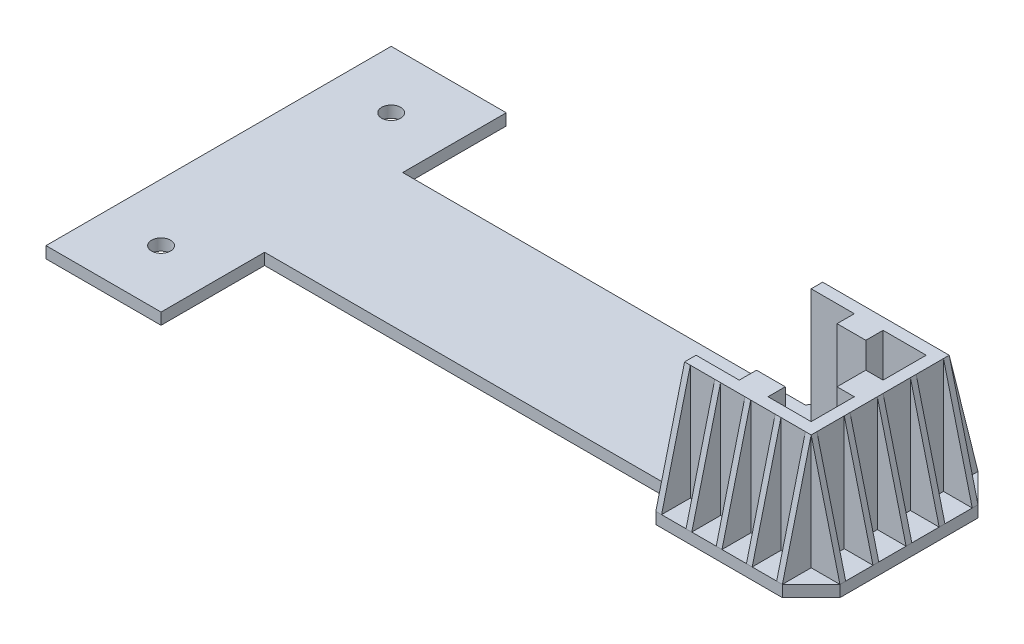
from build123d import *

# Parameters (mm, degrees)
SKETCH1_R           = 1.65
SKETCH1_R_2         = 2.5
BOSS_EXTRUDE1_DEPTH = 2
BOSS_EXTRUDE2_DEPTH = 20
SKETCH4_W           = 1
SKETCH4_H           = 5
BOSS_EXTRUDE3_DEPTH = 22
SKETCH5_W           = 5
SKETCH5_H           = 1
BOSS_EXTRUDE4_DEPTH = 22
BOSS_EXTRUDE5_DEPTH = 2
CHAMFER1_SIZE       = 5
CHAMFER1_SIZE2      = 20


with BuildPart() as part:
    # Sketch1 → Boss-Extrude1 (new body)
    with BuildSketch(Plane(origin=(0, 0, 0), x_dir=(1, 0, 0), z_dir=(0, 1, 0))):
        Polygon((20, 18), (115, 18), (115, 42), (20, 42), (20, 60), (0, 60), (0, 0), (20, 0), align=None)
        with Locations(Location((10, 10, 0), (0, 0, 270))):
            Circle(SKETCH1_R, mode=Mode.SUBTRACT)
        with Locations(Location((10, 50, 0), (0, 0, 270))):
            Circle(SKETCH1_R, mode=Mode.SUBTRACT)
        with Locations(Location((103, 30, 0), (0, 0, 270))):
            Circle(SKETCH1_R_2, mode=Mode.SUBTRACT)
    extrude(amount=BOSS_EXTRUDE1_DEPTH)

    # Sketch2 → Boss-Extrude2 (add)
    with BuildSketch(Plane(origin=(0, 2, 0), x_dir=(1, 0, 0), z_dir=(0, 1, 0))):
        Polygon((115, 42), (93, 42), (93, 40), (100.5, 40), (100.5, 37), (105.5, 37), (105.5, 40), (113, 40), (113, 32.5), (110, 32.5), (110, 27.5), (113, 27.5), (113, 20), (105.5, 20), (105.5, 23), (100.5, 23), (100.5, 20), (93, 20), (93, 18), (115, 18), align=None)
    extrude(amount=BOSS_EXTRUDE2_DEPTH)

    # Sketch4 → Boss-Extrude3 (add)
    with BuildSketch(Plane(origin=(0, 0, 0), x_dir=(1, 0, 0), z_dir=(0, 1, 0))):
        with Locations((98.75, 15.5)):
            Rectangle(SKETCH4_W, SKETCH4_H)
        with Locations((93.5, 15.5)):
            Rectangle(SKETCH4_W, SKETCH4_H)
        with Locations((104, 15.5)):
            Rectangle(SKETCH4_W, SKETCH4_H)
        with Locations((109.25, 15.5)):
            Rectangle(SKETCH4_W, SKETCH4_H)
        with Locations((114.5, 15.5)):
            Rectangle(SKETCH4_W, SKETCH4_H)
        with Locations((114.5, 44.5)):
            Rectangle(SKETCH4_W, SKETCH4_H)
        with Locations((109.25, 44.5)):
            Rectangle(SKETCH4_W, SKETCH4_H)
        with Locations((104, 44.5)):
            Rectangle(SKETCH4_W, SKETCH4_H)
        with Locations((98.75, 44.5)):
            Rectangle(SKETCH4_W, SKETCH4_H)
        with Locations((93.5, 44.5)):
            Rectangle(SKETCH4_W, SKETCH4_H)
    extrude(amount=BOSS_EXTRUDE3_DEPTH)

    # Sketch5 → Boss-Extrude4 (add)
    with BuildSketch(Plane(origin=(0, 0, 0), x_dir=(1, 0, 0), z_dir=(0, 1, 0))):
        with Locations((117.5, 18.5)):
            Rectangle(SKETCH5_W, SKETCH5_H)
        with Locations((117.5, 24.25)):
            Rectangle(SKETCH5_W, SKETCH5_H)
        with Locations((117.5, 30)):
            Rectangle(SKETCH5_W, SKETCH5_H)
        with Locations((117.5, 35.75)):
            Rectangle(SKETCH5_W, SKETCH5_H)
        with Locations((117.5, 41.5)):
            Rectangle(SKETCH5_W, SKETCH5_H)
    extrude(amount=BOSS_EXTRUDE4_DEPTH)

    # Sketch6 → Boss-Extrude5 (add)
    with BuildSketch(Plane(origin=(0, 0, 0), x_dir=(1, 0, 0), z_dir=(0, 1, 0))):
        Polygon((90, 42), (115, 42), (115, 18), (90, 18), (93, 13), (115, 13), (120, 18), (120, 42), (115, 47), (93, 47), align=None)
    extrude(amount=BOSS_EXTRUDE5_DEPTH)

    # Chamfer1
    chamfer1_edges = [part.edges().sort_by_distance(p)[0] for p in [
        (93.5, 22, -47),
        (98.75, 22, -47),
        (104, 22, -47),
        (109.25, 22, -47),
        (120, 22, -41.5),
        (120, 22, -35.75),
        (120, 22, -30),
        (120, 22, -18.5),
        (114.5, 22, -13),
        (109.25, 22, -13),
        (104, 22, -13),
        (98.75, 22, -13),
        (114.5, 22, -47),
        (120, 22, -24.25),
        (93.5, 22, -13),
    ]]
    chamfer1_side = [part.faces().sort_by_distance(p)[0] for p in [
        (93.565834133, 22, -15.5),
    ]]
    chamfer(chamfer1_edges, length=CHAMFER1_SIZE, length2=CHAMFER1_SIZE2, reference=chamfer1_side[0])


solid = part.part
